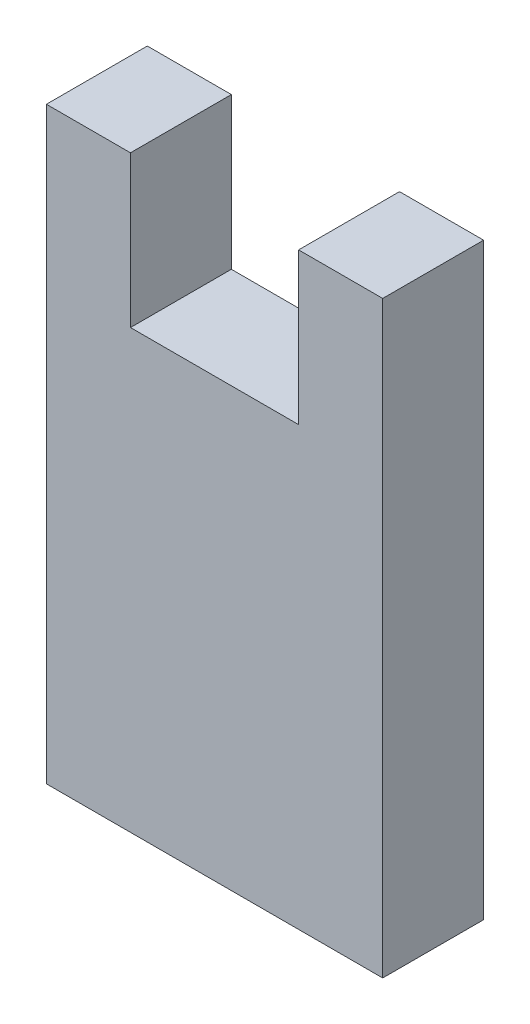
from build123d import *

# Parameters (mm, degrees)
SZKIC1_W                    = 40
SZKIC1_H                    = 70
DODANIE_WYCI_GNI_CIE1_DEPTH = 12
SZKIC2_W                    = 20
SZKIC2_H                    = 18
WYTNIJ_WYCI_GNI_CIE1_DEPTH  = 43.05948169


with BuildPart() as part:
    # Szkic1 → Dodanie-wyciągnięcie1 (new body)
    with BuildSketch(Plane.XY):
        Rectangle(SZKIC1_W, SZKIC1_H)
    extrude(amount=DODANIE_WYCI_GNI_CIE1_DEPTH)

    # Szkic2 → Wytnij-wyciągnięcie1 (cut, through all)
    with BuildSketch(Plane.XY.offset(12)):
        with Locations((0, 26)):
            Rectangle(SZKIC2_W, SZKIC2_H)
    extrude(amount=-WYTNIJ_WYCI_GNI_CIE1_DEPTH, mode=Mode.SUBTRACT)


solid = part.part
